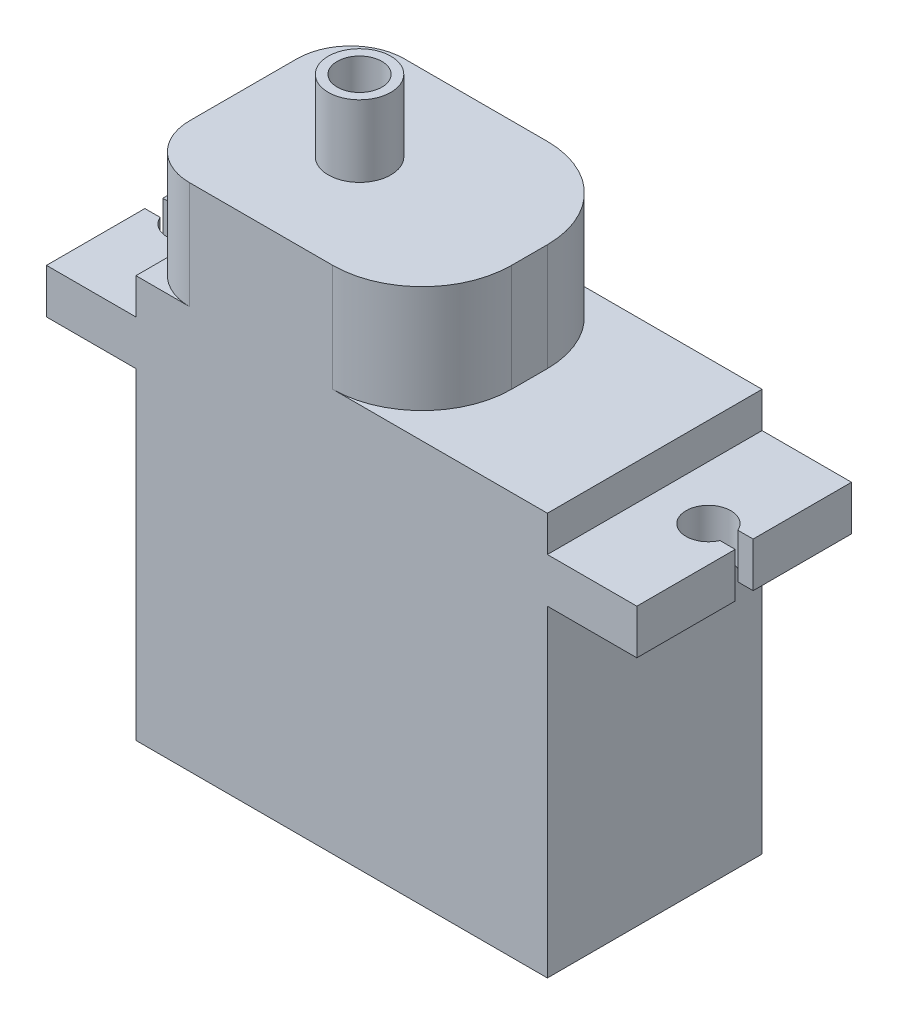
from build123d import *

# Parameters (mm, degrees)
SKETCH1_W           = 23
SKETCH1_H           = 12
BOSS_EXTRUDE1_DEPTH = 22.5
SKETCH2_W           = 12
SKETCH2_H           = 2.5
BOSS_EXTRUDE2_DEPTH = 5
CUT_EXTRUDE1_DEPTH  = 5
BOSS_EXTRUDE3_DEPTH = 6
FILLET1_R           = 5
SKETCH5_R           = 1.75
BOSS_EXTRUDE4_DEPTH = 4
SKETCH6_R           = 1.25
CUT_EXTRUDE2_DEPTH  = 4


with BuildPart() as part:
    # Sketch1 → Boss-Extrude1 (new body)
    with BuildSketch(Plane(origin=(0, 0, 0), x_dir=(1, 0, 0), z_dir=(0, 1, 0))):
        Rectangle(SKETCH1_W, SKETCH1_H)
    extrude(amount=BOSS_EXTRUDE1_DEPTH)

    # Sketch2 → Boss-Extrude2 (add)
    with BuildSketch(Plane(origin=(11.5, 0, 0), x_dir=(0, 0, -1), z_dir=(1, 0, 0))):
        with Locations((0, 19.25)):
            Rectangle(SKETCH2_W, SKETCH2_H)
    boss_extrude2 = extrude(amount=BOSS_EXTRUDE2_DEPTH)

    # Sketch3 → Cut-Extrude1 (cut)
    with BuildSketch(Plane(origin=(0, 20.5, 0), x_dir=(1, 0, 0), z_dir=(0, 1, 0))):
        with BuildLine():
            Line((15.645643924, 0.5), (16.5, 0.5))
            Line((16.5, 0.5), (16.5, -0.5))
            Line((16.5, -0.5), (15.645643924, -0.5))
            ThreePointArc((15.645643924, -0.5), (13.25, 0), (15.645643924, 0.5))
        make_face()
    cut_extrude1 = extrude(amount=-CUT_EXTRUDE1_DEPTH, mode=Mode.SUBTRACT)

    # Mirror1: Boss-Extrude2, Cut-Extrude1 across plane
    add(boss_extrude2.mirror(Plane(origin=(0, 0, 0), x_dir=(0, 0, 1), z_dir=(1, 0, 0))))
    add(cut_extrude1.mirror(Plane(origin=(0, 0, 0), x_dir=(0, 0, 1), z_dir=(1, 0, 0))), mode=Mode.SUBTRACT)

    # Sketch4 → Boss-Extrude3 (add)
    with BuildSketch(Plane(origin=(0, 22.5, 0), x_dir=(1, 0, 0), z_dir=(0, 1, 0))):
        with BuildLine():
            Line((-8.5, 6), (4.5, 6))
            Line((4.5, 6), (4.5, -6))
            Line((4.5, -6), (-8.5, -6))
            ThreePointArc((-8.5, -6), (-10.621320344, -5.121320344), (-11.5, -3))
            Line((-11.5, -3), (-11.5, 3))
            ThreePointArc((-11.5, 3), (-10.621320344, 5.121320344), (-8.5, 6))
        make_face()
    extrude(amount=BOSS_EXTRUDE3_DEPTH)

    # Fillet1
    fillet1_edges = [part.edges().sort_by_distance(p)[0] for p in [
        (4.5, 25.5, 6),
        (4.5, 25.5, -6),
    ]]
    fillet(fillet1_edges, radius=FILLET1_R)

    # Sketch5 → Boss-Extrude4 (add)
    with BuildSketch(Plane(origin=(0, 28.5, 0), x_dir=(1, 0, 0), z_dir=(0, 1, 0))):
        with Locations(Location((-5, 0, 0), (0, 0, 270))):
            Circle(SKETCH5_R)
    extrude(amount=BOSS_EXTRUDE4_DEPTH)

    # Sketch6 → Cut-Extrude2 (cut)
    with BuildSketch(Plane(origin=(0, 32.5, 0), x_dir=(1, 0, 0), z_dir=(0, 1, 0))):
        with Locations(Location((-5, 0, 0), (0, 0, 270))):
            Circle(SKETCH6_R)
    extrude(amount=-CUT_EXTRUDE2_DEPTH, mode=Mode.SUBTRACT)


solid = part.part
